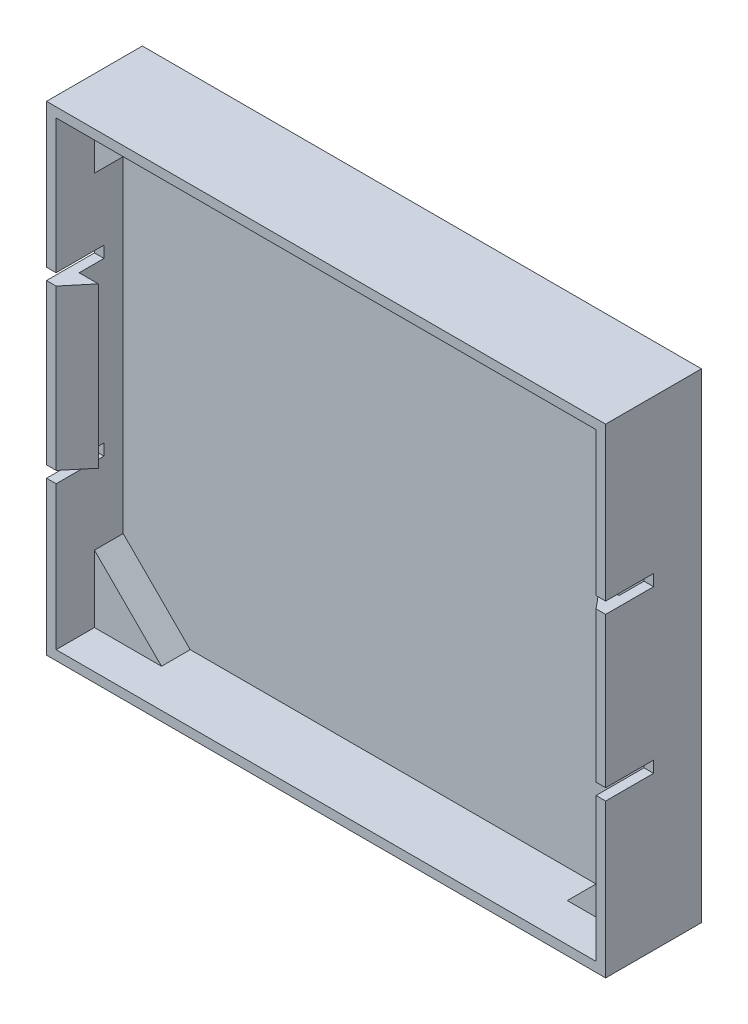
from build123d import *

# Parameters (mm, degrees)
SKETCH_1_W          = 58.36
SKETCH_1_H          = 50.07
EXTRUDE_1_DEPTH     = 3
SKETCH_2_W          = 58.36
SKETCH_2_H          = 50.07
SKETCH_2_W_2        = 56.36
SKETCH_2_H_2        = 48.07
EXTRUDE_2_DEPTH     = 7
EXTRUDE_3_DEPTH     = 3
SKETCH_4_W          = 1
SKETCH_4_H          = 1.2
CUT_EXTRUDE_1_DEPTH = 5
EXTRUDE_4_DEPTH     = 15.67
EXTRUDE_5_DEPTH     = 16.67


with BuildPart() as part:
    # 草圖1 → 填料-伸長1 (new body)
    with BuildSketch(Plane.XY):
        with Locations((4.337567568, 6.83036036)):
            Rectangle(SKETCH_1_W, SKETCH_1_H)
    extrude(amount=EXTRUDE_1_DEPTH)

    # 草圖2 → 填料-伸長2 (add)
    with BuildSketch(Plane.XY.offset(3)):
        with Locations((4.337567568, 6.83036036)):
            Rectangle(SKETCH_2_W, SKETCH_2_H)
        with Locations((4.337567568, 6.83036036)):
            Rectangle(SKETCH_2_W_2, SKETCH_2_H_2, mode=Mode.SUBTRACT)
    extrude(amount=EXTRUDE_2_DEPTH)

    # 草圖3 → 填料-伸長3 (add)
    with BuildSketch(Plane.XY.offset(3)):
        Polygon((-23.842432432, 30.86536036), (-23.842432432, 23.86536036), (-16.842432432, 30.86536036), align=None)
        Polygon((32.517567568, -17.20463964), (32.517567568, -10.20463964), (25.517567568, -17.20463964), align=None)
        Polygon((32.517567568, 30.86536036), (32.517567568, 23.86536036), (25.517567568, 30.86536036), align=None)
        Polygon((-23.842432432, -17.20463964), (-23.842432432, -10.20463964), (-16.842432432, -17.20463964), align=None)
    extrude(amount=EXTRUDE_3_DEPTH)

    # 草圖4 → 除料-伸長1 (cut)
    with BuildSketch(Plane.XY.offset(10)):
        with Locations((-24.342432432, -1.60463964)):
            Rectangle(SKETCH_4_W, SKETCH_4_H)
        with Locations((-24.342432432, 16.26536036)):
            Rectangle(SKETCH_4_W, SKETCH_4_H)
        with Locations((33.017567568, -1.60463964)):
            Rectangle(SKETCH_4_W, SKETCH_4_H)
        with Locations((33.017567568, 15.26536036)):
            Rectangle(SKETCH_4_W, SKETCH_4_H)
    extrude(amount=-CUT_EXTRUDE_1_DEPTH, mode=Mode.SUBTRACT)

    # 草圖5 → 填料-伸長4 (add)
    with BuildSketch(Plane.XZ.offset(1.00463964)):
        Polygon((32.517567568, 10), (30.517567568, 7.6), (32.517567568, 7.6), align=None)
    extrude(amount=-EXTRUDE_4_DEPTH)

    # 草圖6 → 填料-伸長5 (add)
    with BuildSketch(Plane.XZ.offset(1.00463964)):
        Polygon((-23.842432432, 10), (-21.842432432, 7.6), (-23.842432432, 7.6), align=None)
    extrude(amount=-EXTRUDE_5_DEPTH)


solid = part.part
